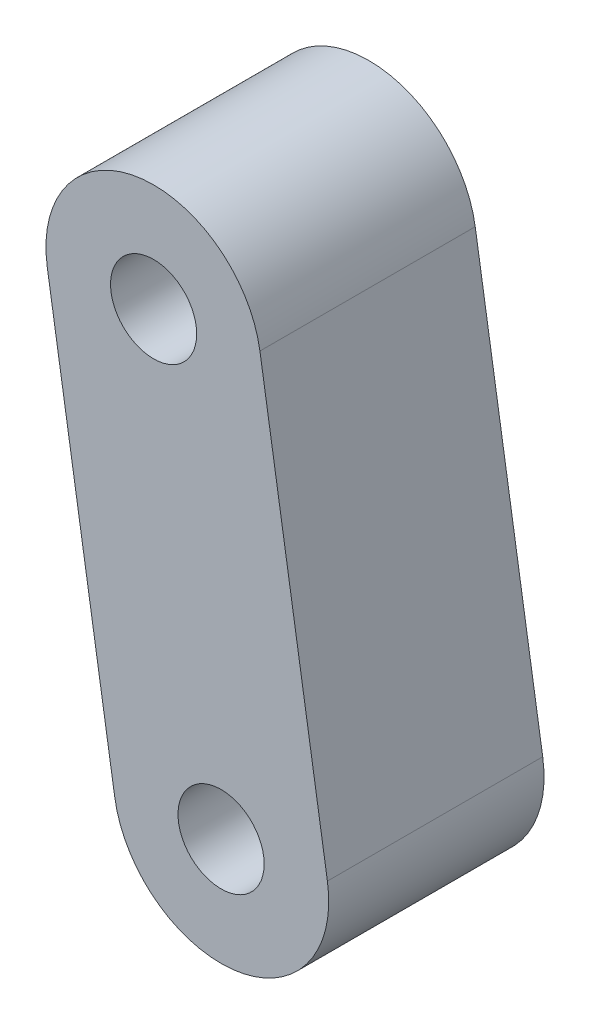
from build123d import *

# Parameters (mm, degrees)
SKETCH1_R           = 2
BOSS_EXTRUDE1_DEPTH = 10


with BuildPart() as part:
    # Sketch1 → Boss-Extrude1 (new body)
    with BuildSketch(Plane.XY):
        with BuildLine():
            Line((-64.072556879, 14.969286371), (-60.938217786, -4.783584773))
            ThreePointArc((-60.938217786, -4.783584773), (-55.216415227, -8.938217786), (-51.061782214, -3.216415227))
            Line((-51.061782214, -3.216415227), (-54.196121307, 16.536455918))
            ThreePointArc((-54.196121307, 16.536455918), (-59.917923866, 20.691088931), (-64.072556879, 14.969286371))
        make_face()
        with Locations((-59.134339093, 15.752871145)):
            Circle(SKETCH1_R, mode=Mode.SUBTRACT)
        with Locations((-56, -4)):
            Circle(SKETCH1_R, mode=Mode.SUBTRACT)
    extrude(amount=BOSS_EXTRUDE1_DEPTH)


solid = part.part
